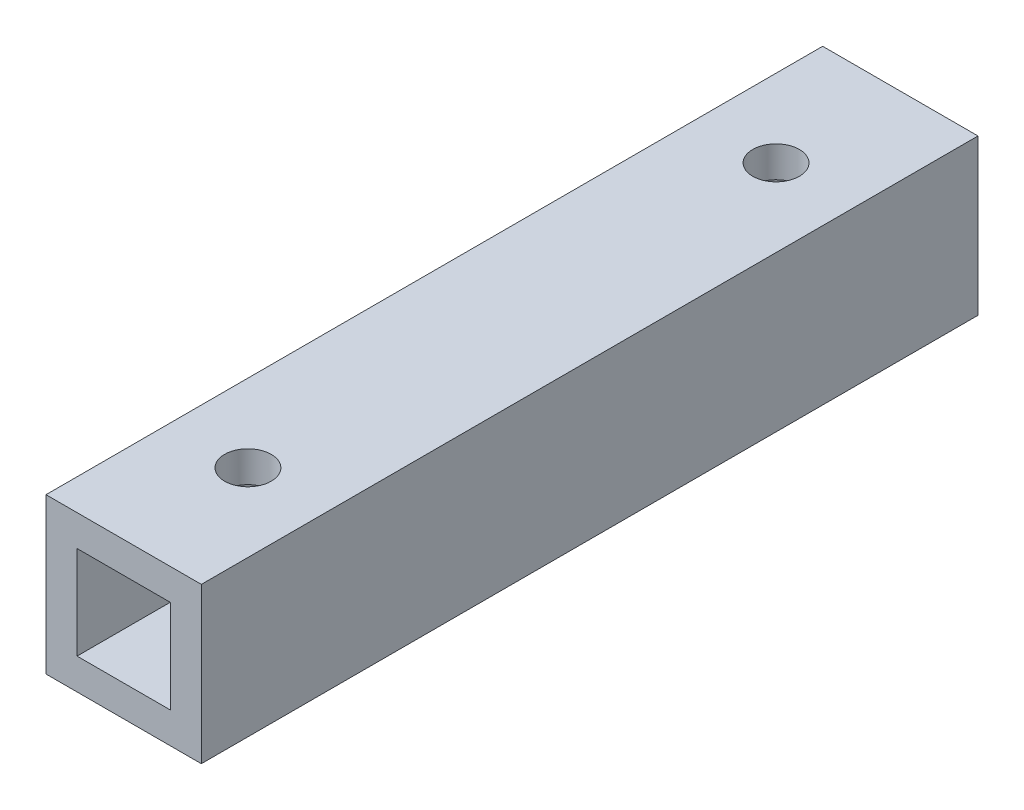
from build123d import *

# Parameters (mm, degrees)
SKETCH_2_W               = 10
SKETCH_2_H               = 10
EXTRUDE_1_DEPTH          = 25
SKETCH_3_R               = 1.5
CUT_EXTRUDE_1_DEPTH      = 28.386127875
CUT_EXTRUDE_2_DEPTH      = 51.497524692
CUT_EXTRUDE_2_DEPTH_BACK = 51.497524692
SKETCH_4_W               = 6
SKETCH_4_H               = 6


with BuildPart() as part:
    # 草图2 → 凸台-拉伸1 (new, symmetric)
    with BuildSketch(Plane.XY):
        Rectangle(SKETCH_2_W, SKETCH_2_H)
    extrude(amount=EXTRUDE_1_DEPTH, both=True)

    # 草图3 → 切除-拉伸1 (cut, symmetric)
    with BuildSketch(Plane(origin=(0, 5, 0), x_dir=(1, 0, 0), z_dir=(0, 1, 0))):
        with Locations(Location((0, 17, 0), (0, 0, 270))):
            Circle(SKETCH_3_R)
    cut_extrude_1 = extrude(amount=CUT_EXTRUDE_1_DEPTH, both=True, mode=Mode.SUBTRACT)

    # 镜向1: 切除-拉伸1 across plane
    add(cut_extrude_1.mirror(Plane.XY), mode=Mode.SUBTRACT)

    # 草图4 → 切除-拉伸2 (cut, two sides: drawn at the far end of the back side and taken through both)
    with BuildSketch(Plane.XY.offset(25).offset(-CUT_EXTRUDE_2_DEPTH_BACK)):
        Rectangle(SKETCH_4_W, SKETCH_4_H)
    extrude(amount=CUT_EXTRUDE_2_DEPTH + CUT_EXTRUDE_2_DEPTH_BACK, mode=Mode.SUBTRACT)


solid = part.part
